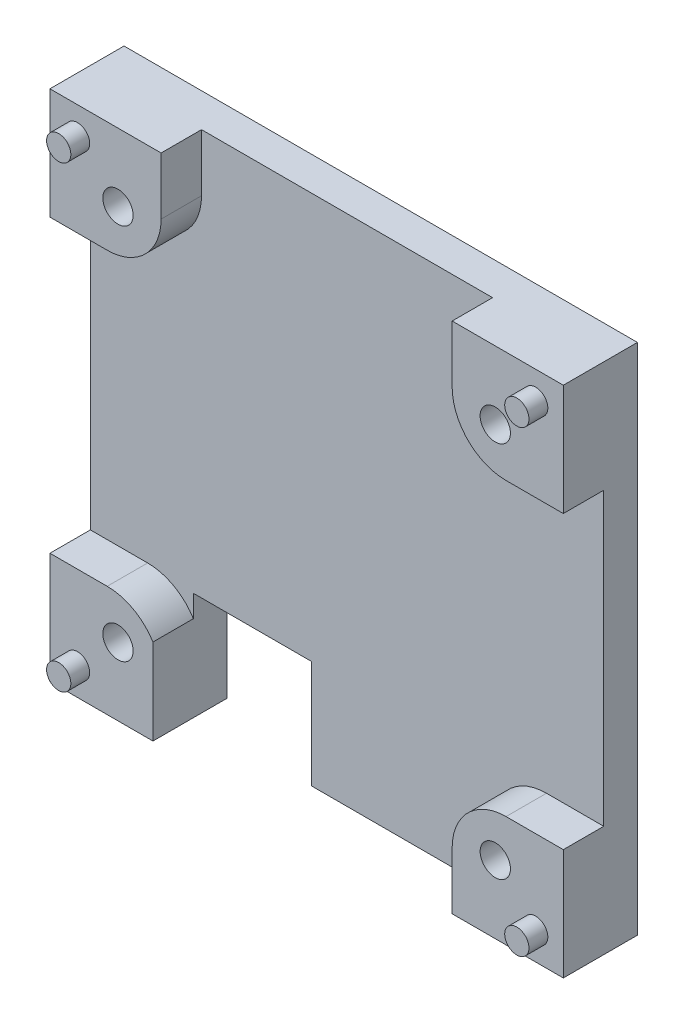
from build123d import *

# Parameters (mm, degrees)
SKETCH3_W           = 38.1
SKETCH3_H           = 38.1
SKETCH3_R           = 1.125
BOSS_EXTRUDE1_DEPTH = 2.5
BOSS_EXTRUDE2_START = 3
SKETCH2_R           = 1.125
BOSS_EXTRUDE2_DEPTH = 3
SKETCH4_W           = 8.75
SKETCH4_H           = 5.25
CUT_EXTRUDE1_DEPTH  = 10
SKETCH6_W           = 8.75
SKETCH6_H           = 2.75
CUT_EXTRUDE2_DEPTH  = 10
SKETCH7_R           = 0.9
BOSS_EXTRUDE3_DEPTH = 1.4


with BuildPart() as part:
    # Sketch3 → Boss-Extrude1 (new body)
    with BuildSketch(Plane.XY):
        with Locations((0.466348003, 11.564505911)):
            Rectangle(SKETCH3_W, SKETCH3_H)
        with Locations((-13.533651997, 25.564505911)):
            Circle(SKETCH3_R, mode=Mode.SUBTRACT)
        with Locations((14.466348003, 25.564505911)):
            Circle(SKETCH3_R, mode=Mode.SUBTRACT)
        with Locations((14.466348003, -2.435494089)):
            Circle(SKETCH3_R, mode=Mode.SUBTRACT)
        with Locations((-13.533651997, -2.435494089)):
            Circle(SKETCH3_R, mode=Mode.SUBTRACT)
    extrude(amount=-BOSS_EXTRUDE1_DEPTH)

    # Sketch2 → Boss-Extrude2 (add)
    # profile 1 of 4: a face of its own
    with BuildSketch(Plane.XY.offset(BOSS_EXTRUDE2_START)):
        with BuildLine():
            Line((-18.583651997, 30.614505911), (-10.333651997, 30.614505911))
            Line((-10.333651997, 30.614505911), (-10.333651997, 26.364505911))
            ThreePointArc((-10.333651997, 26.364505911), (-11.505224872, 23.536078787), (-14.333651997, 22.364505911))
            Line((-14.333651997, 22.364505911), (-18.583651997, 22.364505911))
            Line((-18.583651997, 22.364505911), (-18.583651997, 30.614505911))
        make_face()
        with Locations((-13.533651997, 25.564505911)):
            Circle(SKETCH2_R, mode=Mode.SUBTRACT)
    # profile 2 of 4: a face of its own
    with BuildSketch(Plane.XY.offset(BOSS_EXTRUDE2_START)):
        with BuildLine():
            Line((19.516348003, 30.614505911), (11.266348003, 30.614505911))
            Line((11.266348003, 30.614505911), (11.266348003, 26.364505911))
            ThreePointArc((11.266348003, 26.364505911), (12.437920878, 23.536078787), (15.266348003, 22.364505911))
            Line((15.266348003, 22.364505911), (19.516348003, 22.364505911))
            Line((19.516348003, 22.364505911), (19.516348003, 30.614505911))
        make_face()
        with Locations((14.466348003, 25.564505911)):
            Circle(SKETCH2_R, mode=Mode.SUBTRACT)
    # profile 3 of 4: a face of its own
    with BuildSketch(Plane.XY.offset(BOSS_EXTRUDE2_START)):
        with BuildLine():
            Line((19.516348003, -7.485494089), (11.266348003, -7.485494089))
            Line((11.266348003, -7.485494089), (11.266348003, -3.235494089))
            ThreePointArc((11.266348003, -3.235494089), (12.437920878, -0.407066964), (15.266348003, 0.764505911))
            Line((15.266348003, 0.764505911), (19.516348003, 0.764505911))
            Line((19.516348003, 0.764505911), (19.516348003, -7.485494089))
        make_face()
        with Locations((14.466348003, -2.435494089)):
            Circle(SKETCH2_R, mode=Mode.SUBTRACT)
    # profile 4 of 4: a face of its own
    with BuildSketch(Plane.XY.offset(BOSS_EXTRUDE2_START)):
        with BuildLine():
            Line((-18.583651997, -7.485494089), (-10.333651997, -7.485494089))
            Line((-10.333651997, -7.485494089), (-10.333651997, -3.235494089))
            ThreePointArc((-10.333651997, -3.235494089), (-11.505224872, -0.407066964), (-14.333651997, 0.764505911))
            Line((-14.333651997, 0.764505911), (-18.583651997, 0.764505911))
            Line((-18.583651997, 0.764505911), (-18.583651997, -7.485494089))
        make_face()
        with Locations((-13.533651997, -2.435494089)):
            Circle(SKETCH2_R, mode=Mode.SUBTRACT)
    extrude(amount=-BOSS_EXTRUDE2_DEPTH)

    # Sketch4 → Cut-Extrude1 (cut)
    with BuildSketch(Plane(origin=(0, 0, -2.5), x_dir=(-1, 0, 0), z_dir=(0, 0, -1))):
        with Locations((6.563651997, -2.110494089)):
            Rectangle(SKETCH4_W, SKETCH4_H)
    extrude(amount=-CUT_EXTRUDE1_DEPTH, mode=Mode.SUBTRACT)

    # Sketch6 → Cut-Extrude2 (cut)
    with BuildSketch(Plane(origin=(0, 0, -2.5), x_dir=(-1, 0, 0), z_dir=(0, 0, -1))):
        with Locations((6.563651997, -6.110494089)):
            Rectangle(SKETCH6_W, SKETCH6_H)
    extrude(amount=-CUT_EXTRUDE2_DEPTH, mode=Mode.SUBTRACT)

    # Sketch7 → Boss-Extrude3 (add)
    with BuildSketch(Plane.XY.offset(3)):
        with Locations((-16.533651997, 28.564505911)):
            Circle(SKETCH7_R)
        with Locations(Location((17.466348003, 28.564505911, 0), (0, 0, 180))):
            Circle(SKETCH7_R)
        with Locations((17.466348003, -5.435494089)):
            Circle(SKETCH7_R)
        with Locations(Location((-16.533651997, -5.435494089, 0), (0, 0, 180))):
            Circle(SKETCH7_R)
    extrude(amount=BOSS_EXTRUDE3_DEPTH)


solid = part.part
